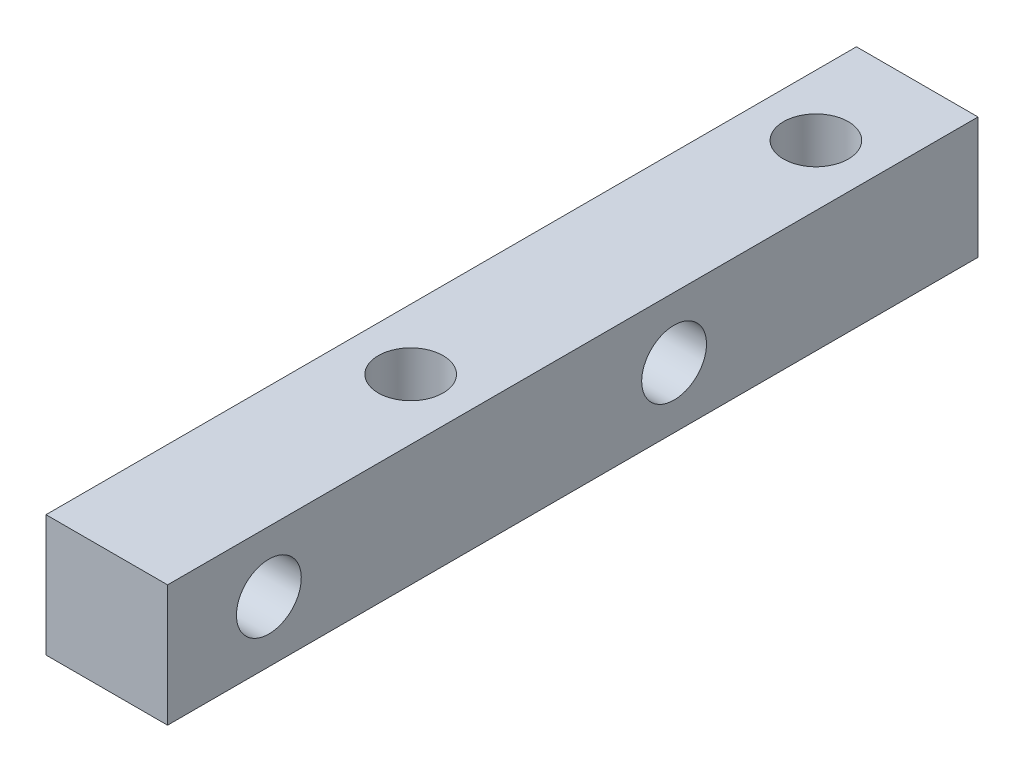
from build123d import *

# Parameters (mm, degrees)
SKETCH_1_W          = 6
SKETCH_1_H          = 6
EXTRUDE_1_DEPTH     = 40
SKETCH_2_R          = 1.6
CUT_EXTRUDE_1_DEPTH = 24
SKETCH_3_R          = 1.6
CUT_EXTRUDE_2_DEPTH = 24


with BuildPart() as part:
    # 草图1 → 凸台-拉伸1 (new body)
    with BuildSketch(Plane.XY):
        with Locations((3, -3)):
            Rectangle(SKETCH_1_W, SKETCH_1_H)
    extrude(amount=EXTRUDE_1_DEPTH)

    # 草图2 → 切除-拉伸1 (cut, symmetric)
    with BuildSketch(Plane(origin=(6, 0, 0), x_dir=(0, 0, -1), z_dir=(1, 0, 0))):
        with Locations(Location((-35, -3, 0), (0, 0, 270))):
            Circle(SKETCH_2_R)
        with Locations(Location((-15, -3, 0), (0, 0, 270))):
            Circle(SKETCH_2_R)
    extrude(amount=CUT_EXTRUDE_1_DEPTH, both=True, mode=Mode.SUBTRACT)

    # 草图3 → 切除-拉伸2 (cut, symmetric)
    with BuildSketch(Plane(origin=(0, 0, 0), x_dir=(1, 0, 0), z_dir=(0, 1, 0))):
        with Locations(Location((3, -5, 0), (0, 0, 270))):
            Circle(SKETCH_3_R)
        with Locations(Location((3, -25, 0), (0, 0, 270))):
            Circle(SKETCH_3_R)
    extrude(amount=CUT_EXTRUDE_2_DEPTH, both=True, mode=Mode.SUBTRACT)


solid = part.part
